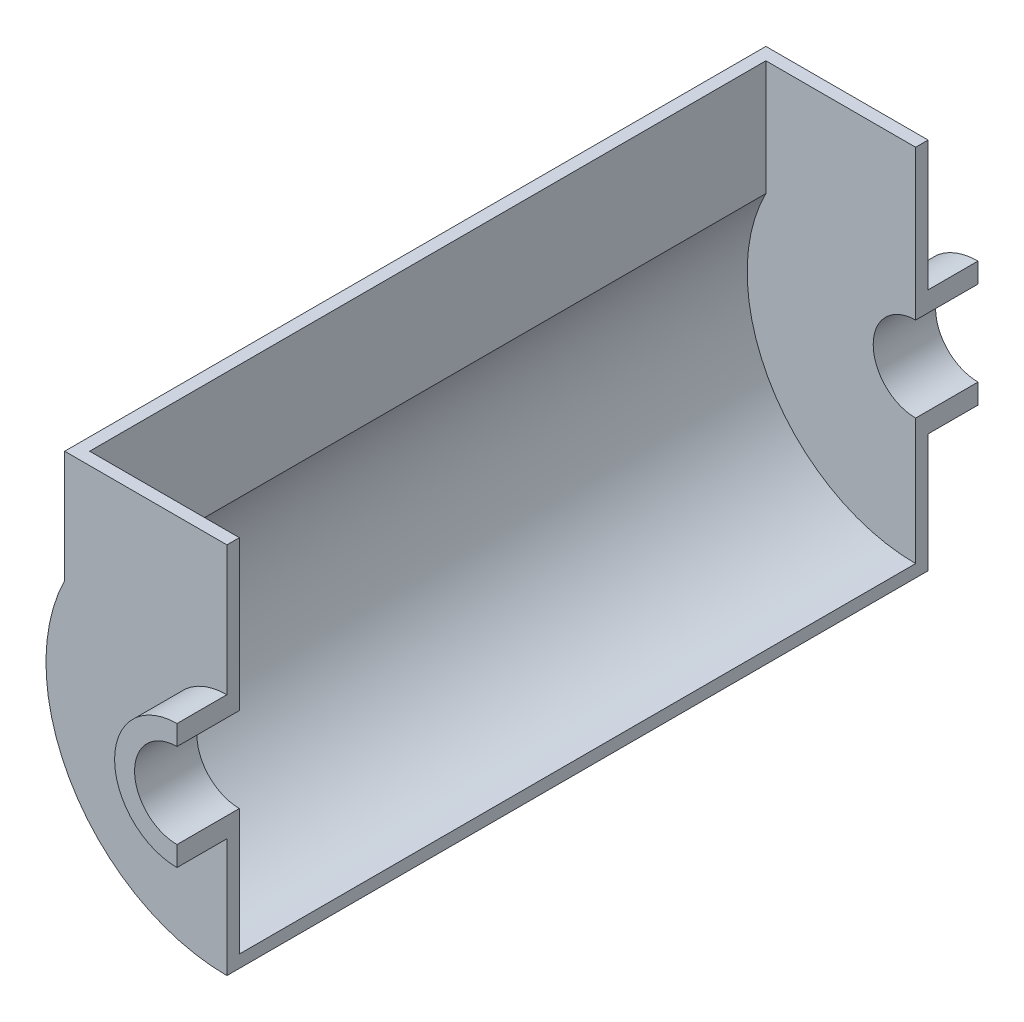
from build123d import *

# Parameters (mm, degrees)
BOSS_EXTRUDE1_DEPTH      = 20
BOSS_EXTRUDE1_DEPTH_BACK = 5
BOSS_EXTRUDE2_START      = -5
BOSS_EXTRUDE2_DEPTH      = 5
BOSS_EXTRUDE3_REACH      = 316.327


with BuildPart() as part:
    # Sketch1 → Boss-Extrude1 (new, two sides: drawn at the far end of the back side and taken through both)
    with BuildSketch(Plane.XY.offset(-BOSS_EXTRUDE1_DEPTH_BACK)):
        with BuildLine():
            Line((0, 25), (0, 17))
            ThreePointArc((0, 17), (-17, 0), (0, -17))
            Line((0, -17), (0, -25))
            ThreePointArc((0, -25), (-25, 0), (0, 25))
        make_face()
    extrude(amount=BOSS_EXTRUDE1_DEPTH + BOSS_EXTRUDE1_DEPTH_BACK)

    # Sketch2 → Boss-Extrude2 (add)
    with BuildSketch(Plane.XY.offset(BOSS_EXTRUDE2_START)):
        with BuildLine():
            Line((0, 25), (0, 77))
            Line((0, 77), (-65, 77))
            Line((-65, 77), (-65, 32.113081447))
            ThreePointArc((-65, 32.113081447), (-61.581037686, -38.262590053), (0, -72.5))
            Line((0, -72.5), (0, -25))
            ThreePointArc((0, -25), (-25, 0), (0, 25))
        make_face()
    extrude(amount=BOSS_EXTRUDE2_DEPTH)


with BuildPart() as body_2:
    # Mirror2: mirrored copy
    add(part.part.mirror(Plane.XY.offset(-140.5)))

    # Sketch4 → Boss-Extrude3 (add, up to next)
    with BuildSketch(Plane(origin=(0, 0, -5), x_dir=(-1, 0, 0), z_dir=(0, 0, -1)), mode=Mode.PRIVATE) as boss_extrude3_sk1:
        with BuildLine():
            Line((65, 77), (65, 32.113081447))
            ThreePointArc((65, 32.113081447), (61.581037686, -38.262590053), (0, -72.5))
            Line((0, -72.5), (0, -67.5))
            ThreePointArc((0, -67.5), (57.634938288, -35.134938288), (60, 30.923292192))
            Line((60, 30.923292192), (60, 77))
            Line((60, 77), (65, 77))
        make_face()
    boss_extrude3_tool1 = extrude(boss_extrude3_sk1.sketch, amount=BOSS_EXTRUDE3_REACH, mode=Mode.PRIVATE) - body_2.part

    add(part.part)  # Boss-Extrude3 merges part
    add(boss_extrude3_tool1.solids().sort_by_distance((-61.66152, 53.961646, -5))[0])


solid = body_2.part
